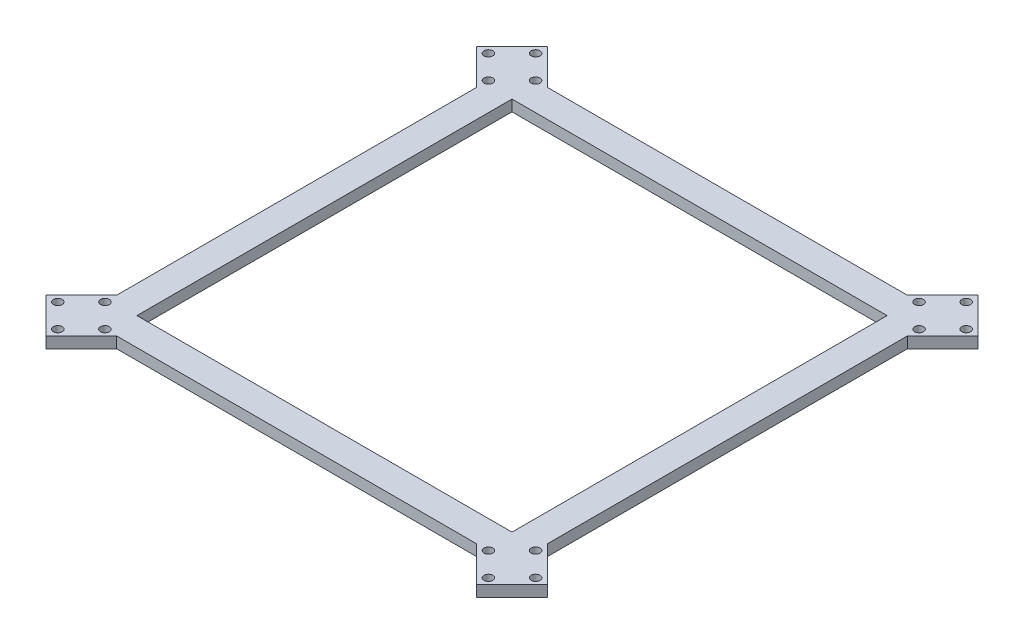
from build123d import *

# Parameters (mm, degrees)
SKETCH_1_R      = 1.6
SKETCH_1_W      = 135
SKETCH_1_H      = 135
EXTRUDE_1_DEPTH = 4


with BuildPart() as part:
    # 草图1 → 凸台-拉伸1 (new body)
    with BuildSketch(Plane(origin=(0, 0, 0), x_dir=(1, 0, 0), z_dir=(0, 1, 0))):
        Polygon((90.227922061, 77.5), (77.5, 64.772077939), (77.5, -64.772077939), (90.227922061, -77.5), (77.5, -90.227922061), (64.772077939, -77.5), (-64.772077939, -77.5), (-77.5, -90.227922061), (-90.227922061, -77.5), (-77.5, -64.772077939), (-77.5, 64.772077939), (-90.227922061, 77.5), (-77.5, 90.227922061), (-64.772077939, 77.5), (64.772077939, 77.5), (77.5, 90.227922061), align=None)
        with Locations(Location((77.5, 85.985281374, 0), (0, 0, 270))):
            Circle(SKETCH_1_R, mode=Mode.SUBTRACT)
        with Locations(Location((69.014718626, 77.5, 0), (0, 0, 270))):
            Circle(SKETCH_1_R, mode=Mode.SUBTRACT)
        with Locations(Location((77.5, 69.014718626, 0), (0, 0, 270))):
            Circle(SKETCH_1_R, mode=Mode.SUBTRACT)
        with Locations(Location((85.985281374, 77.5, 0), (0, 0, 270))):
            Circle(SKETCH_1_R, mode=Mode.SUBTRACT)
        with Locations(Location((85.985281374, -77.5, 0), (0, 0, 90))):
            Circle(SKETCH_1_R, mode=Mode.SUBTRACT)
        with Locations(Location((77.5, -69.014718626, 0), (0, 0, 90))):
            Circle(SKETCH_1_R, mode=Mode.SUBTRACT)
        with Locations(Location((69.014718626, -77.5, 0), (0, 0, 90))):
            Circle(SKETCH_1_R, mode=Mode.SUBTRACT)
        with Locations(Location((77.5, -85.985281374, 0), (0, 0, 90))):
            Circle(SKETCH_1_R, mode=Mode.SUBTRACT)
        with Locations(Location((-77.5, -85.985281374, 0), (0, 0, 270))):
            Circle(SKETCH_1_R, mode=Mode.SUBTRACT)
        with Locations(Location((-69.014718626, -77.5, 0), (0, 0, 270))):
            Circle(SKETCH_1_R, mode=Mode.SUBTRACT)
        with Locations(Location((-77.5, -69.014718626, 0), (0, 0, 270))):
            Circle(SKETCH_1_R, mode=Mode.SUBTRACT)
        with Locations(Location((-85.985281374, -77.5, 0), (0, 0, 270))):
            Circle(SKETCH_1_R, mode=Mode.SUBTRACT)
        with Locations(Location((-85.985281374, 77.5, 0), (0, 0, 90))):
            Circle(SKETCH_1_R, mode=Mode.SUBTRACT)
        with Locations(Location((-77.5, 69.014718626, 0), (0, 0, 90))):
            Circle(SKETCH_1_R, mode=Mode.SUBTRACT)
        with Locations(Location((-69.014718626, 77.5, 0), (0, 0, 90))):
            Circle(SKETCH_1_R, mode=Mode.SUBTRACT)
        with Locations(Location((-77.5, 85.985281374, 0), (0, 0, 90))):
            Circle(SKETCH_1_R, mode=Mode.SUBTRACT)
        Rectangle(SKETCH_1_W, SKETCH_1_H, mode=Mode.SUBTRACT)
    extrude(amount=EXTRUDE_1_DEPTH)


solid = part.part
